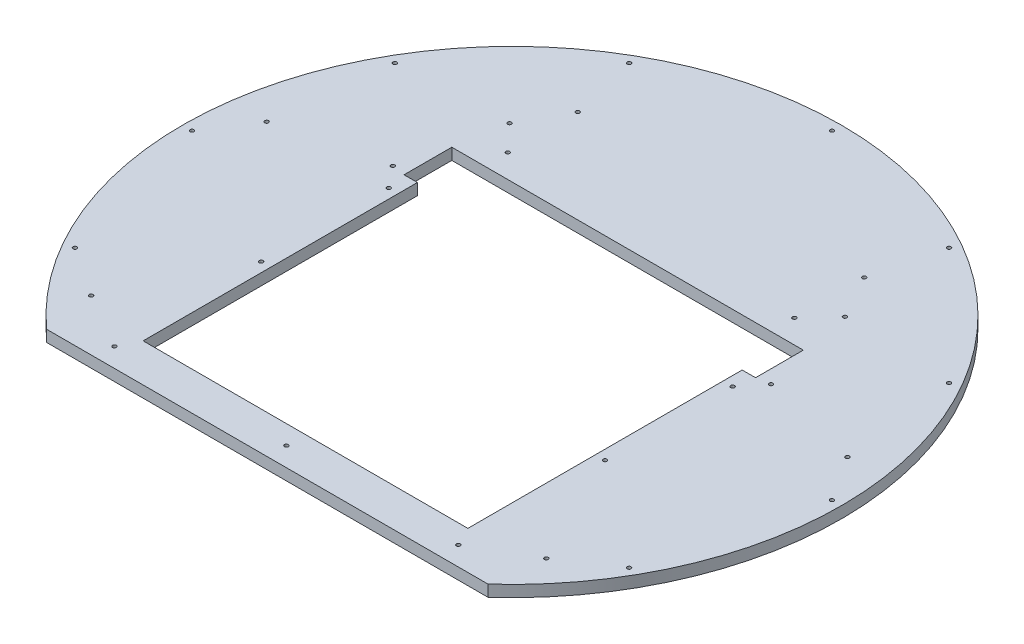
from build123d import *

# Parameters (mm, degrees)
BOSS_EXTRUDE1_DEPTH = 6
SKETCH4_R           = 1
CUT_EXTRUDE2_DEPTH  = 230.888016217
SKETCH5_W           = 200
SKETCH5_H           = 20
BOSS_EXTRUDE2_DEPTH = 6
SKETCH6_W           = 184
SKETCH6_H           = 25
CUT_EXTRUDE3_DEPTH  = 230.888016217
SKETCH7_R           = 1
CUT_EXTRUDE4_DEPTH  = 6
BOSS_EXTRUDE3_DEPTH = 6
SKETCH9_R           = 1
CUT_EXTRUDE5_DEPTH  = 245.02561341
SKETCH10_W          = 15
SKETCH10_H          = 143.586884574
BOSS_EXTRUDE4_DEPTH = 6
SKETCH11_R          = 1
CUT_EXTRUDE6_DEPTH  = 245.02561341


with BuildPart() as part:
    # Sketch2 → Boss-Extrude1 (new body)
    with BuildSketch(Plane(origin=(0, 0, 0), x_dir=(1, 0, 0), z_dir=(0, 1, 0))):
        with BuildLine():
            Line((-100, -128.086884574), (-100, 35.5))
            Line((-100, 35.5), (100, 35.5))
            Line((100, 35.5), (100, -128.086884574))
            ThreePointArc((100, -128.086884574), (0, 162.5), (-100, -128.086884574))
        make_face()
    extrude(amount=BOSS_EXTRUDE1_DEPTH)

    # Sketch4 → Cut-Extrude2 (cut, through all)
    with BuildSketch(Plane(origin=(0, 6, 0), x_dir=(1, 0, 0), z_dir=(0, 1, 0))):
        with Locations(Location((119.15, -101.158131161, 0), (0, 0, 270))):
            Circle(SKETCH4_R)
        with Locations(Location((87.75, 86.5, 0), (0, 0, 270))):
            Circle(SKETCH4_R)
        with Locations(Location((152, 23.589123318, 0), (0, 0, 270))):
            Circle(SKETCH4_R)
        with Locations(Location((-87.75, 86.5, 0), (0, 0, 90))):
            Circle(SKETCH4_R)
        with Locations(Location((99, 36.6, 0), (0, 0, 270))):
            Circle(SKETCH4_R)
        with Locations(Location((-99, 36.6, 0), (0, 0, 90))):
            Circle(SKETCH4_R)
        with Locations(Location((-152, 23.589123318, 0), (0, 0, 90))):
            Circle(SKETCH4_R)
        with Locations(Location((-119.15, -101.158131161, 0), (0, 0, 90))):
            Circle(SKETCH4_R)
    extrude(amount=-CUT_EXTRUDE2_DEPTH, mode=Mode.SUBTRACT)

    # Sketch5 → Boss-Extrude2 (add)
    with BuildSketch(Plane(origin=(0, 6, 0), x_dir=(1, 0, 0), z_dir=(0, 1, 0))):
        with Locations((0, -118.086884574)):
            Rectangle(SKETCH5_W, SKETCH5_H)
    extrude(amount=-BOSS_EXTRUDE2_DEPTH)

    # Sketch6 → Cut-Extrude3 (cut, through all)
    with BuildSketch(Plane(origin=(0, 6, 0), x_dir=(1, 0, 0), z_dir=(0, 1, 0))):
        with Locations((0, 48)):
            Rectangle(SKETCH6_W, SKETCH6_H)
    extrude(amount=-CUT_EXTRUDE3_DEPTH, mode=Mode.SUBTRACT)

    # Sketch7 → Cut-Extrude4 (cut)
    with BuildSketch(Plane(origin=(0, 6, 0), x_dir=(1, 0, 0), z_dir=(0, 1, 0))):
        with Locations(Location((-75, 72.8, 0), (0, 0, 270))):
            Circle(SKETCH7_R)
        with Locations(Location((-75, 109.4, 0), (0, 0, 270))):
            Circle(SKETCH7_R)
        with Locations(Location((75, 109.4, 0), (0, 0, 90))):
            Circle(SKETCH7_R)
        with Locations(Location((75, 72.8, 0), (0, 0, 90))):
            Circle(SKETCH7_R)
    extrude(amount=-CUT_EXTRUDE4_DEPTH, mode=Mode.SUBTRACT)

    # Sketch8 → Boss-Extrude3 (add, through all)
    with BuildSketch(Plane(origin=(0, 6, 0), x_dir=(1, 0, 0), z_dir=(0, 1, 0))):
        with BuildLine():
            Line((-100, -128.086884574), (-115.542200083, -128.086884574))
            ThreePointArc((-115.542200083, -128.086884574), (0, 172.5), (115.542200083, -128.086884574))
            Line((115.542200083, -128.086884574), (100, -128.086884574))
            ThreePointArc((100, -128.086884574), (0, 162.5), (-100, -128.086884574))
        make_face()
    extrude(amount=-BOSS_EXTRUDE3_DEPTH)

    # Sketch9 → Cut-Extrude5 (cut, through all)
    with BuildSketch(Plane(origin=(0, 6, 0), x_dir=(1, 0, 0), z_dir=(0, 1, 0))):
        with Locations(Location((0, 167.5, 0), (0, 0, 270))):
            Circle(SKETCH9_R)
        with Locations(Location((83.75, 145.059255134, 0), (0, 0, 270))):
            Circle(SKETCH9_R)
        with Locations(Location((145.059255134, 83.75, 0), (0, 0, 270))):
            Circle(SKETCH9_R)
        with Locations(Location((167.5, 0, 0), (0, 0, 270))):
            Circle(SKETCH9_R)
        with Locations(Location((145.059255134, -83.75, 0), (0, 0, 270))):
            Circle(SKETCH9_R)
        with Locations((83.75, -145.059255134)):
            Circle(SKETCH9_R)
        with Locations((0, -167.5)):
            Circle(SKETCH9_R)
        with Locations((-83.75, -145.059255134)):
            Circle(SKETCH9_R)
        with Locations(Location((-145.059255134, -83.75, 0), (0, 0, 270))):
            Circle(SKETCH9_R)
        with Locations(Location((-167.5, 0, 0), (0, 0, 270))):
            Circle(SKETCH9_R)
        with Locations(Location((-145.059255134, 83.75, 0), (0, 0, 270))):
            Circle(SKETCH9_R)
        with Locations(Location((-83.75, 145.059255134, 0), (0, 0, 270))):
            Circle(SKETCH9_R)
    extrude(amount=-CUT_EXTRUDE5_DEPTH, mode=Mode.SUBTRACT)

    # Sketch10 → Boss-Extrude4 (add, through all)
    with BuildSketch(Plane(origin=(0, 6, 0), x_dir=(1, 0, 0), z_dir=(0, 1, 0))):
        with Locations((-92.5, -36.293442287)):
            Rectangle(SKETCH10_W, SKETCH10_H)
        with Locations((92.5, -36.293442287)):
            Rectangle(SKETCH10_W, SKETCH10_H)
    extrude(amount=-BOSS_EXTRUDE4_DEPTH)

    # Sketch11 → Cut-Extrude6 (cut, through all)
    with BuildSketch(Plane(origin=(0, 6, 0), x_dir=(1, 0, 0), z_dir=(0, 1, 0))):
        with Locations(Location((-90, -118.086884574, 0), (0, 0, 270))):
            Circle(SKETCH11_R)
        with Locations(Location((0, -118.086884574, 0), (0, 0, 270))):
            Circle(SKETCH11_R)
        with Locations(Location((90, -118.086884574, 0), (0, 0, 270))):
            Circle(SKETCH11_R)
        with Locations(Location((-90, 25.5, 0), (0, 0, 270))):
            Circle(SKETCH11_R)
        with Locations(Location((-90, -41.293442287, 0), (0, 0, 270))):
            Circle(SKETCH11_R)
        with Locations(Location((90, -41.293442287, 0), (0, 0, 90))):
            Circle(SKETCH11_R)
        with Locations(Location((90, 25.5, 0), (0, 0, 90))):
            Circle(SKETCH11_R)
    extrude(amount=-CUT_EXTRUDE6_DEPTH, mode=Mode.SUBTRACT)


solid = part.part
